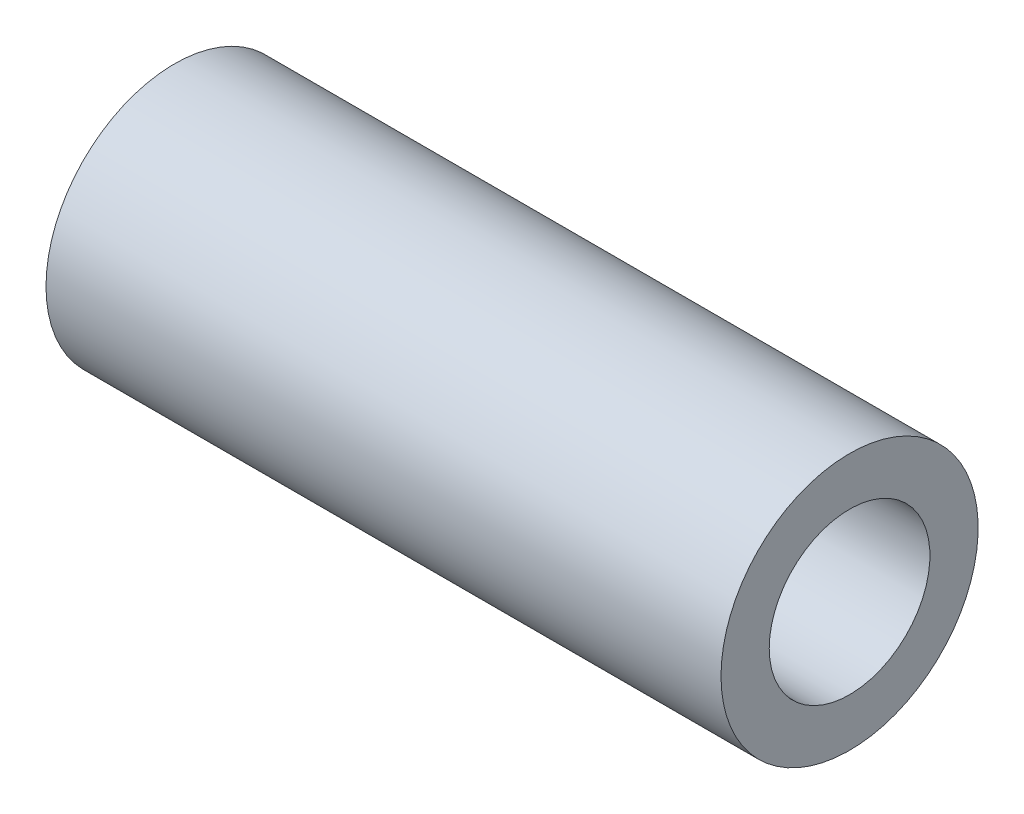
from build123d import *

# Parameters (mm, degrees)
SKETCH1_R           = 4
SKETCH1_R_2         = 2.5
BOSS_EXTRUDE1_DEPTH = 10.5


with BuildPart() as part:
    # Sketch1 → Boss-Extrude1 (new, symmetric)
    with BuildSketch(Plane(origin=(0, 0, 0), x_dir=(0, 0, -1), z_dir=(1, 0, 0))):
        with Locations(Location((0, 0, 0), (0, 0, 180))):
            Circle(SKETCH1_R)
        with Locations(Location((0, 0, 0), (0, 0, 180))):
            Circle(SKETCH1_R_2, mode=Mode.SUBTRACT)
    extrude(amount=BOSS_EXTRUDE1_DEPTH, both=True)


solid = part.part
